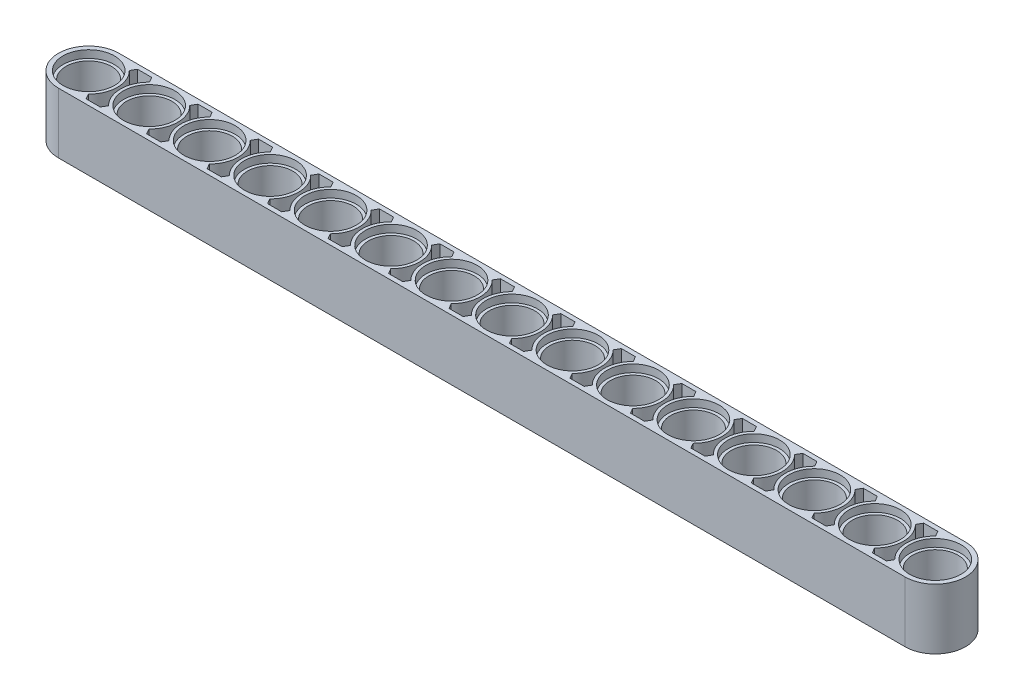
from build123d import *

# Parameters (mm, degrees)
SKETCH1_R            = 3
BOSS_EXTRUDE1_DEPTH  = 8
CUT_EXTRUDE1_START   = -1
SKETCH2_R            = 3.4
SKETCH2_R_2          = 3
CUT_EXTRUDE1_DEPTH   = 1
LPATTERN1_COUNT      = 15
LPATTERN1_PITCH      = 8
LPATTERN1_COUNT_DIR2 = 2
LPATTERN1_PITCH_DIR2 = 7
CUT_EXTRUDE2_DEPTH   = 3
LPATTERN2_COUNT      = 14
LPATTERN2_PITCH      = 8
LPATTERN2_COUNT_DIR2 = 2
LPATTERN2_PITCH_DIR2 = 5


with BuildPart() as part:
    # Sketch1 → Boss-Extrude1 (new body)
    with BuildSketch(Plane(origin=(0, 0, 0), x_dir=(1, 0, 0), z_dir=(0, 1, 0))):
        with BuildLine():
            Line((0, 4), (112, 4))
            ThreePointArc((112, 4), (116, 0), (112, -4))
            Line((112, -4), (0, -4))
            ThreePointArc((0, -4), (-4, 0), (0, 4))
        make_face()
        with Locations(Location((8, 0, 0), (0, 0, 270))):
            Circle(SKETCH1_R, mode=Mode.SUBTRACT)
        with Locations(Location((16, 0, 0), (0, 0, 270))):
            Circle(SKETCH1_R, mode=Mode.SUBTRACT)
        with Locations(Location((0, 0, 0), (0, 0, 270))):
            Circle(SKETCH1_R, mode=Mode.SUBTRACT)
        with Locations(Location((24, 0, 0), (0, 0, 270))):
            Circle(SKETCH1_R, mode=Mode.SUBTRACT)
        with Locations(Location((32, 0, 0), (0, 0, 270))):
            Circle(SKETCH1_R, mode=Mode.SUBTRACT)
        with Locations(Location((40, 0, 0), (0, 0, 270))):
            Circle(SKETCH1_R, mode=Mode.SUBTRACT)
        with Locations(Location((48, 0, 0), (0, 0, 270))):
            Circle(SKETCH1_R, mode=Mode.SUBTRACT)
        with Locations(Location((56, 0, 0), (0, 0, 270))):
            Circle(SKETCH1_R, mode=Mode.SUBTRACT)
        with Locations(Location((64, 0, 0), (0, 0, 270))):
            Circle(SKETCH1_R, mode=Mode.SUBTRACT)
        with Locations(Location((72, 0, 0), (0, 0, 270))):
            Circle(SKETCH1_R, mode=Mode.SUBTRACT)
        with Locations(Location((80, 0, 0), (0, 0, 270))):
            Circle(SKETCH1_R, mode=Mode.SUBTRACT)
        with Locations(Location((88, 0, 0), (0, 0, 270))):
            Circle(SKETCH1_R, mode=Mode.SUBTRACT)
        with Locations(Location((96, 0, 0), (0, 0, 270))):
            Circle(SKETCH1_R, mode=Mode.SUBTRACT)
        with Locations(Location((104, 0, 0), (0, 0, 270))):
            Circle(SKETCH1_R, mode=Mode.SUBTRACT)
        with Locations(Location((112, 0, 0), (0, 0, 270))):
            Circle(SKETCH1_R, mode=Mode.SUBTRACT)
    extrude(amount=BOSS_EXTRUDE1_DEPTH)

    # Sketch2 → Cut-Extrude1 (cut)
    with BuildSketch(Plane(origin=(0, 8, 0), x_dir=(1, 0, 0), z_dir=(0, 1, 0)).offset(CUT_EXTRUDE1_START)):
        with Locations(Location((0, 0, 0), (0, 0, 270))):
            Circle(SKETCH2_R)
        with Locations(Location((0, 0, 0), (0, 0, 270))):
            Circle(SKETCH2_R_2, mode=Mode.SUBTRACT)
    cut_extrude1 = extrude(amount=CUT_EXTRUDE1_DEPTH, mode=Mode.SUBTRACT)

    # LPattern1: Cut-Extrude1 15 × 2
    with Locations(*[(i * LPATTERN1_PITCH, -j * LPATTERN1_PITCH_DIR2, 0) for i in range(LPATTERN1_COUNT) for j in range(LPATTERN1_COUNT_DIR2) if (i, j) != (0, 0)]):
        add(cut_extrude1, mode=Mode.SUBTRACT)

    # Sketch3 → Cut-Extrude2 (cut)
    with BuildSketch(Plane(origin=(0, 8, 0), x_dir=(1, 0, 0), z_dir=(0, 1, 0))):
        with BuildLine():
            Line((3.066679245, -3.4), (4.933320755, -3.4))
            Line((4.933320755, -3.4), (5.333320755, -2.707179677))
            ThreePointArc((5.333320755, -2.707179677), (4.2, 0), (5.333320755, 2.707179677))
            Line((5.333320755, 2.707179677), (4.933320755, 3.4))
            Line((4.933320755, 3.4), (3.066679245, 3.4))
            Line((3.066679245, 3.4), (2.666679245, 2.707179677))
            ThreePointArc((2.666679245, 2.707179677), (3.8, 0), (2.666679245, -2.707179677))
            Line((2.666679245, -2.707179677), (3.066679245, -3.4))
        make_face()
    cut_extrude2 = extrude(amount=-CUT_EXTRUDE2_DEPTH, mode=Mode.SUBTRACT)

    # LPattern2: Cut-Extrude2 14 × 2
    with Locations(*[(i * LPATTERN2_PITCH, -j * LPATTERN2_PITCH_DIR2, 0) for i in range(LPATTERN2_COUNT) for j in range(LPATTERN2_COUNT_DIR2) if (i, j) != (0, 0)]):
        add(cut_extrude2, mode=Mode.SUBTRACT)


solid = part.part
